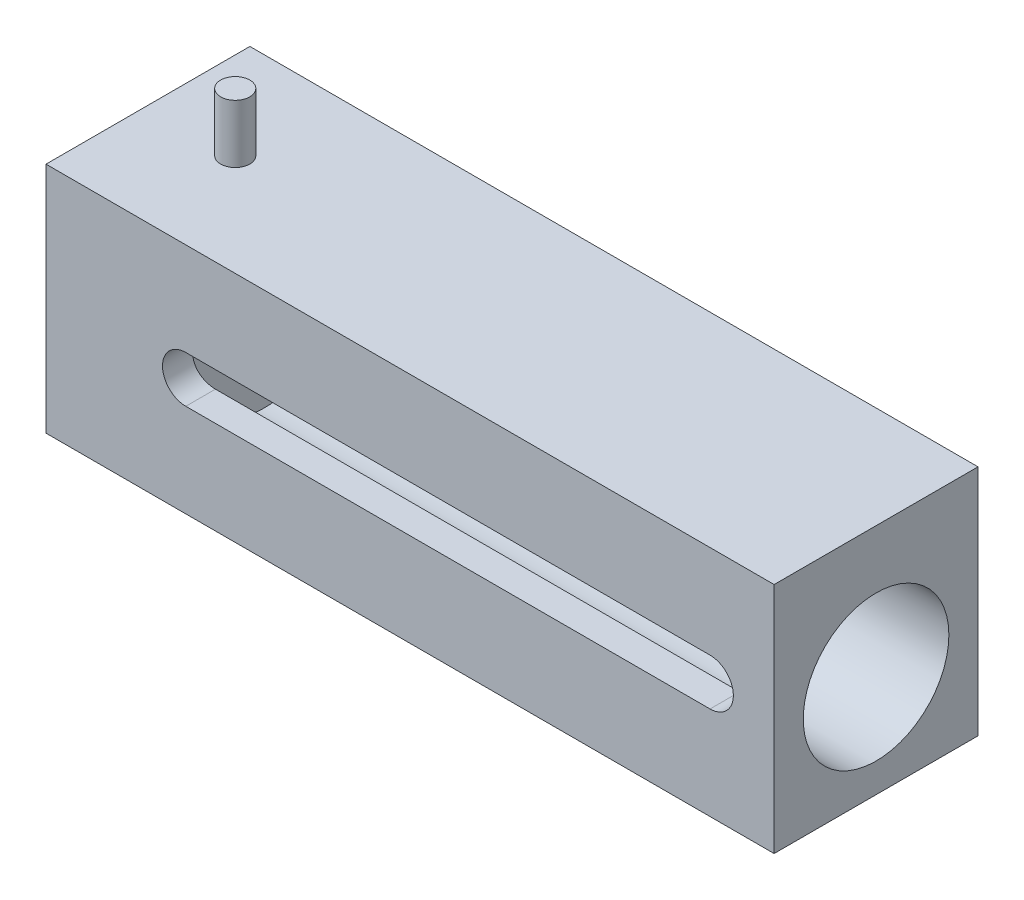
from build123d import *

# Parameters (mm, degrees)
SKETCH1_W               = 250
SKETCH1_H               = 70
BOSS_EXTRUDE1_DEPTH     = 80
SKETCH2_R               = 25
CUT_EXTRUDE1_DEPTH      = 210
CUT_EXTRUDE2_REACH      = 166.088
CUT_EXTRUDE2_END_RADIUS = 25
SKETCH4_R               = 5
BOSS_EXTRUDE2_DEPTH     = 20


with BuildPart() as part:
    # Sketch1 → Boss-Extrude1 (new body)
    with BuildSketch(Plane(origin=(0, 0, 0), x_dir=(1, 0, 0), z_dir=(0, 1, 0))):
        Rectangle(SKETCH1_W, SKETCH1_H)
    extrude(amount=BOSS_EXTRUDE1_DEPTH)

    # Sketch2 → Cut-Extrude1 (cut)
    with BuildSketch(Plane(origin=(125, 0, 0), x_dir=(0, 0, -1), z_dir=(1, 0, 0))):
        with Locations((0, 35)):
            Circle(SKETCH2_R)
    extrude(amount=-CUT_EXTRUDE1_DEPTH, mode=Mode.SUBTRACT)

    # Cut-Extrude2: up to this cylinder (the profile starts outside it)
    cut_extrude2_end = Plane(origin=(13, 35, 0), z_dir=(1, 0, 0)) * Cylinder(CUT_EXTRUDE2_END_RADIUS, 383.176, mode=Mode.PRIVATE)
    # Sketch3 → Cut-Extrude2 (cut, up to the surface)
    with BuildSketch(Plane.XY.offset(35), mode=Mode.PRIVATE) as cut_extrude2_sk1:
        with BuildLine():
            Line((103, 32), (-77, 32))
            ThreePointArc((-77, 32), (-85, 40), (-77, 48))
            Line((-77, 48), (103, 48))
            ThreePointArc((103, 48), (111, 40), (103, 32))
        make_face()
    cut_extrude2_tool1 = extrude(cut_extrude2_sk1.sketch, amount=-CUT_EXTRUDE2_REACH, mode=Mode.PRIVATE) - cut_extrude2_end
    add(cut_extrude2_tool1.solids().sort_by_distance((13, 40, 35))[0], mode=Mode.SUBTRACT)

    # Sketch4 → Boss-Extrude2 (add)
    with BuildSketch(Plane(origin=(0, 80, 0), x_dir=(1, 0, 0), z_dir=(0, 1, 0))):
        with Locations(Location((-95.026953026, 0, 0), (0, 0, 270))):
            Circle(SKETCH4_R)
    extrude(amount=BOSS_EXTRUDE2_DEPTH)


solid = part.part
